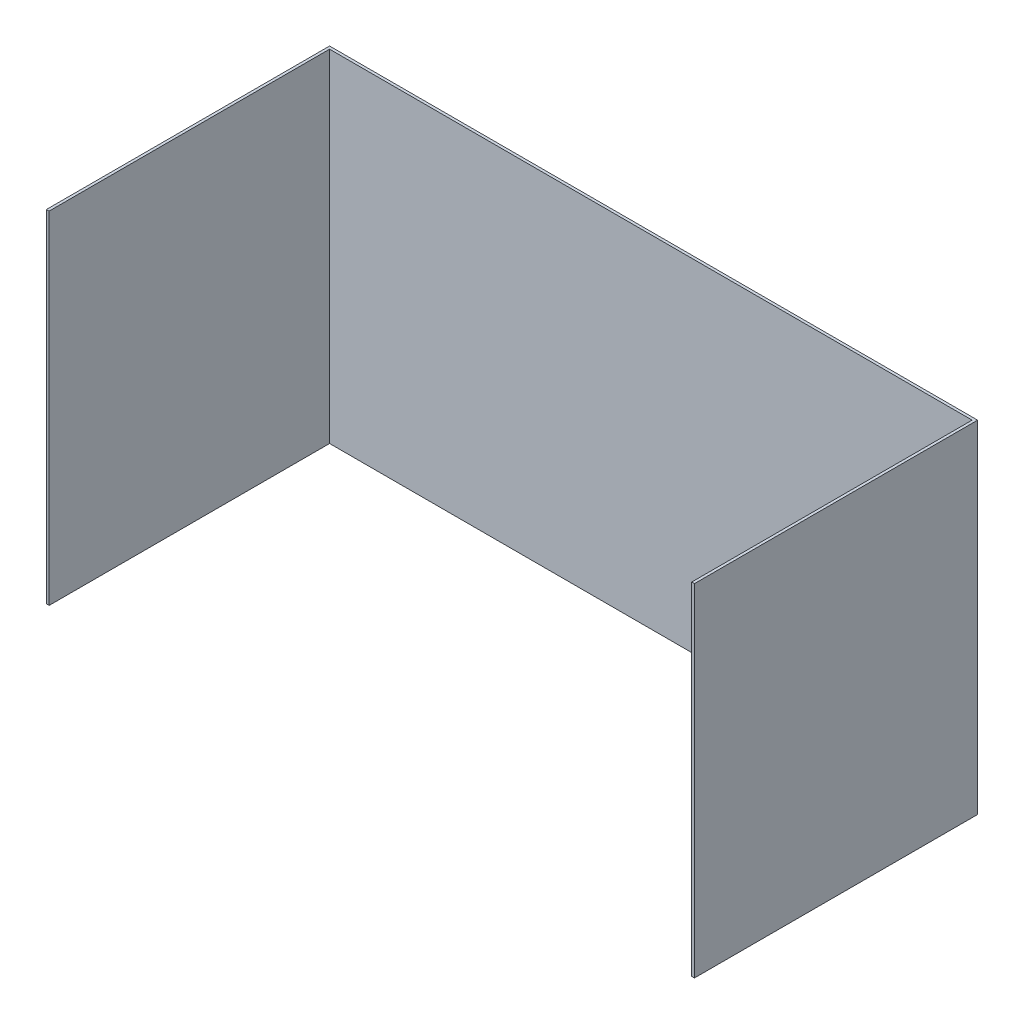
from build123d import *

# Parameters (mm, degrees)
SKETCH1_W           = 755.65
SKETCH1_H           = 398.272
BOSS_EXTRUDE1_DEPTH = 330.2
SKETCH2_W           = 749.3
SKETCH2_H           = 398.272
CUT_EXTRUDE1_DEPTH  = 327.025


with BuildPart() as part:
    # Sketch1 → Boss-Extrude1 (new body)
    with BuildSketch(Plane.XY):
        Rectangle(SKETCH1_W, SKETCH1_H)
    extrude(amount=BOSS_EXTRUDE1_DEPTH)

    # Sketch2 → Cut-Extrude1 (cut)
    with BuildSketch(Plane.XY.offset(330.2)):
        Rectangle(SKETCH2_W, SKETCH2_H)
    extrude(amount=-CUT_EXTRUDE1_DEPTH, mode=Mode.SUBTRACT)


solid = part.part
